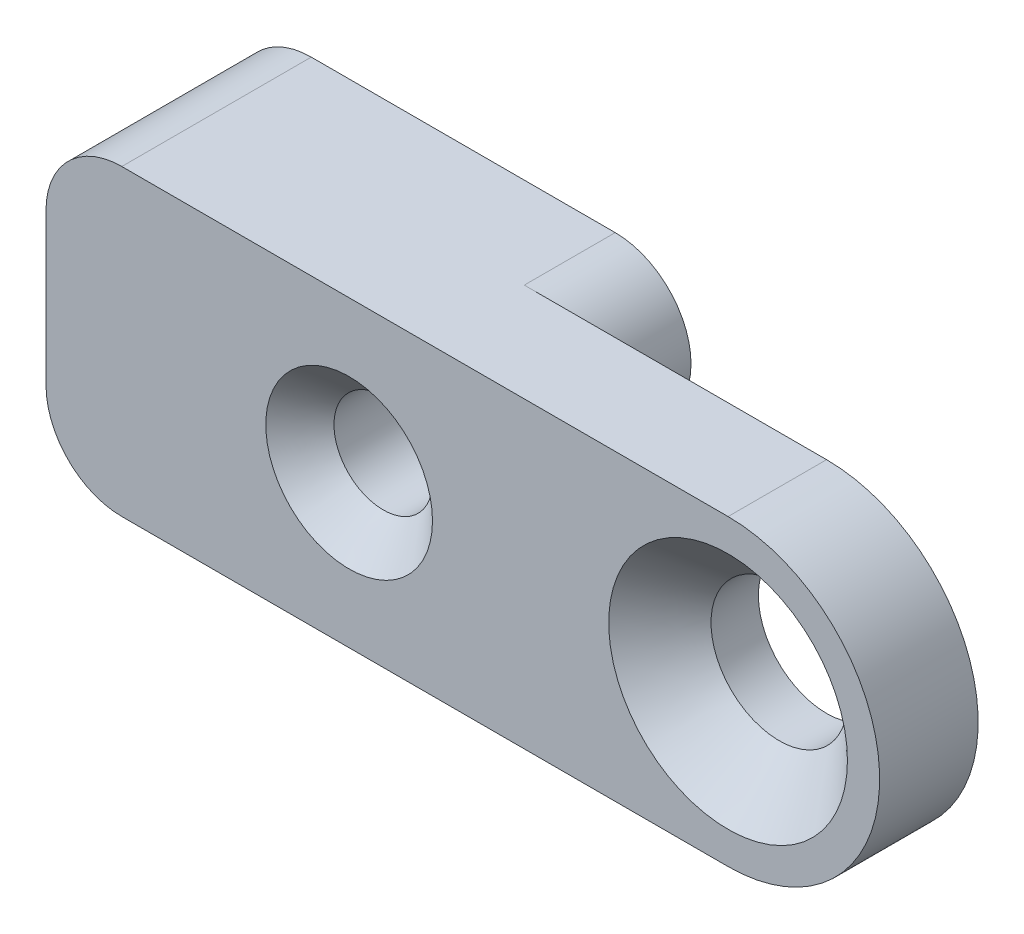
from build123d import *

# Parameters (mm, degrees)
SKETCH1_R                                       = 1.725
BOSS_EXTRUDE1_DEPTH                             = 2
SKETCH2_R                                       = 1
SKETCH2_R_2                                     = 1.725
BOSS_EXTRUDE2_DEPTH                             = 3
SKETCH3_R                                       = 6.225
CUT_EXTRUDE1_DEPTH                              = 2.4
CSK_FOR_M3_FLAT_HEAD_MACHINE_SCREW2_D           = 3.6
CSK_FOR_M3_FLAT_HEAD_MACHINE_SCREW2_CSINK_D     = 6.3
CSK_FOR_M3_FLAT_HEAD_MACHINE_SCREW2_CSINK_ANGLE = 90
CSK_FOR_M2_FLAT_HEAD_MACHINE_SCREW1_D           = 2.6
CSK_FOR_M2_FLAT_HEAD_MACHINE_SCREW1_CSINK_D     = 4.4
CSK_FOR_M2_FLAT_HEAD_MACHINE_SCREW1_CSINK_ANGLE = 90
FILLET1_R                                       = 2


with BuildPart() as part:
    # Sketch1 → Boss-Extrude1 (new body)
    with BuildSketch(Plane.XY):
        with BuildLine():
            Line((10, 4), (-8, 4))
            Line((-8, 4), (-8, 3.010972637))
            Line((-8, 3.010972637), (0.218908182, 2.189081818))
            ThreePointArc((0.218908182, 2.189081818), (2.2, 0), (0.218908182, -2.189081818))
            Line((0.218908182, -2.189081818), (-8, -3.010972637))
            Line((-8, -3.010972637), (-8, -4))
            Line((-8, -4), (10, -4))
            ThreePointArc((10, -4), (14, 0), (10, 4))
        make_face()
        with Locations((10, 0)):
            Circle(SKETCH1_R, mode=Mode.SUBTRACT)
    extrude(amount=BOSS_EXTRUDE1_DEPTH)

    # Sketch2 → Boss-Extrude2 (add)
    with BuildSketch(Plane.XY.offset(2)):
        with BuildLine():
            Line((-8, 4), (-8, -4))
            Line((-8, -4), (10, -4))
            ThreePointArc((10, -4), (14, 0), (10, 4))
            Line((10, 4), (-8, 4))
        make_face()
        Circle(SKETCH2_R, mode=Mode.SUBTRACT)
        with Locations((10, 0)):
            Circle(SKETCH2_R_2, mode=Mode.SUBTRACT)
    extrude(amount=BOSS_EXTRUDE2_DEPTH)

    # Sketch3 → Cut-Extrude1 (cut)
    with BuildSketch(Plane(origin=(0, 0, 0), x_dir=(-1, 0, 0), z_dir=(0, 0, -1))):
        with Locations((-10, 0)):
            Circle(SKETCH3_R)
    extrude(amount=-CUT_EXTRUDE1_DEPTH, mode=Mode.SUBTRACT)

    # CSK for M3 Flat Head Machine Screw2 (through all)
    with Locations(Plane(origin=(10, 0, 5), x_dir=(1, 0, 0), z_dir=(0, 0, 1))):
        with Locations((0, 0)):
            CounterSinkHole(CSK_FOR_M3_FLAT_HEAD_MACHINE_SCREW2_D / 2, CSK_FOR_M3_FLAT_HEAD_MACHINE_SCREW2_CSINK_D / 2, counter_sink_angle=CSK_FOR_M3_FLAT_HEAD_MACHINE_SCREW2_CSINK_ANGLE)

    # CSK for M2 Flat Head Machine Screw1 (through all)
    with Locations(Plane.XY.offset(5)):
        with Locations((0, 0)):
            CounterSinkHole(CSK_FOR_M2_FLAT_HEAD_MACHINE_SCREW1_D / 2, CSK_FOR_M2_FLAT_HEAD_MACHINE_SCREW1_CSINK_D / 2, counter_sink_angle=CSK_FOR_M2_FLAT_HEAD_MACHINE_SCREW1_CSINK_ANGLE)

    # Fillet1
    fillet1_edges = [part.edges().sort_by_distance(p)[0] for p in [
        (5.230238476, 4, 1.2),
        (5.230238476, -4, 1.2),
        (-8, -4, 2.5),
        (-8, 4, 2.5),
    ]]
    fillet(fillet1_edges, radius=FILLET1_R)


solid = part.part
